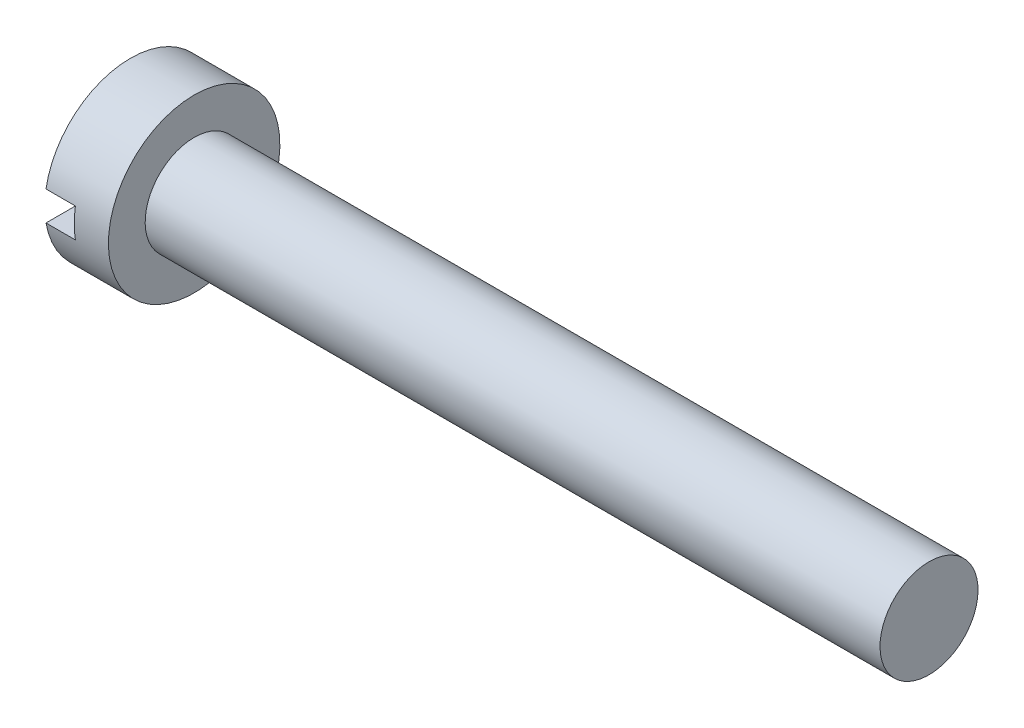
from build123d import *

# Parameters (mm, degrees)
SKETCH2_W          = 7
SKETCH2_H          = 1.2
CUT_EXTRUDE1_DEPTH = 1.2


with BuildPart() as part:
    # Sketch1 → Revolve1 (revolve)
    with BuildSketch(Plane.XY):
        Polygon((0, 0), (0, 3.5), (2.6, 3.5), (2.6, 2), (32.6, 2), (32.6, 0), align=None)
    revolve(axis=Axis((32.6, 0, 0), (-1, 0, 0)))

    # Sketch2 → Cut-Extrude1 (cut)
    with BuildSketch(Plane.ZY):
        Rectangle(SKETCH2_W, SKETCH2_H)
    extrude(amount=-CUT_EXTRUDE1_DEPTH, mode=Mode.SUBTRACT)


solid = part.part
